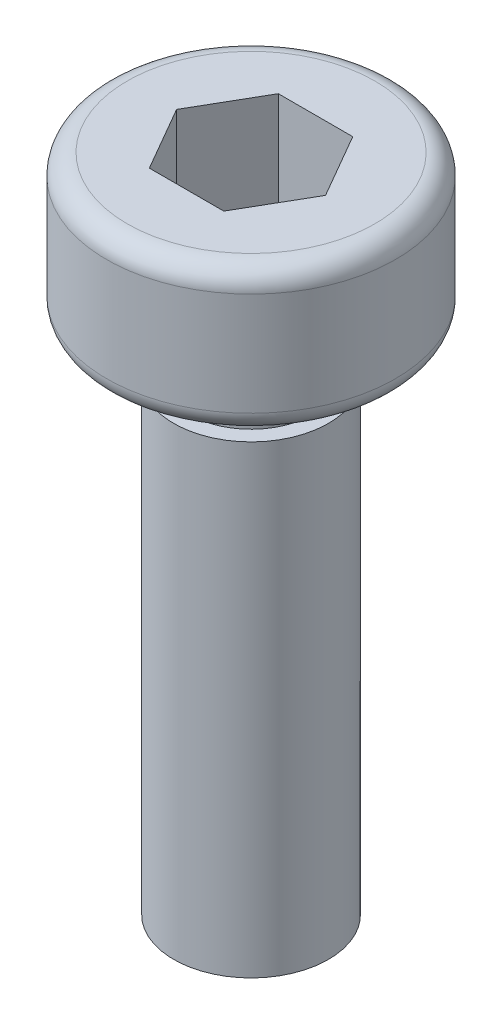
from build123d import *

# Parameters (mm, degrees)
CUT_EXTRUDE_1_DEPTH = 2


with BuildPart() as part:
    # 草图1 → 旋转1 (revolve)
    with BuildSketch(Plane.XY, mode=Mode.PRIVATE) as revolve_1_sk:
        with BuildLine():
            Line((0, 12.8), (-2.4, 12.8))
            ThreePointArc((-2.4, 12.8), (-2.682842712, 12.682842712), (-2.8, 12.4))
            Line((-2.8, 12.4), (-2.8, 10.4))
            ThreePointArc((-2.8, 10.4), (-2.682842712, 10.117157288), (-2.4, 10))
            Line((-2.4, 10), (-1.2, 10))
            Line((-1.2, 10), (-1.2, 9))
            Line((-1.2, 9), (-1.5, 9))
            Line((-1.5, 9), (-1.5, 0))
            Line((-1.5, 0), (0, 0))
            Line((0, 0), (0, 12.8))
        make_face()
    revolve(revolve_1_sk.sketch.rotate(Axis((0, 0, 0), (0, 1, 0)), 270), axis=Axis((0, 0, 0), (0, 1, 0)))

    # 草图2 → 切除-拉伸1 (cut)
    with BuildSketch(Plane(origin=(0, 12.8, 0), x_dir=(1, 0, 0), z_dir=(0, 1, 0))):
        Polygon((-0.721687836, 1.25), (-1.443375673, 0), (-0.721687836, -1.25), (0.721687836, -1.25), (1.443375673, 0), (0.721687836, 1.25), align=None)
    extrude(amount=-CUT_EXTRUDE_1_DEPTH, mode=Mode.SUBTRACT)


solid = part.part
